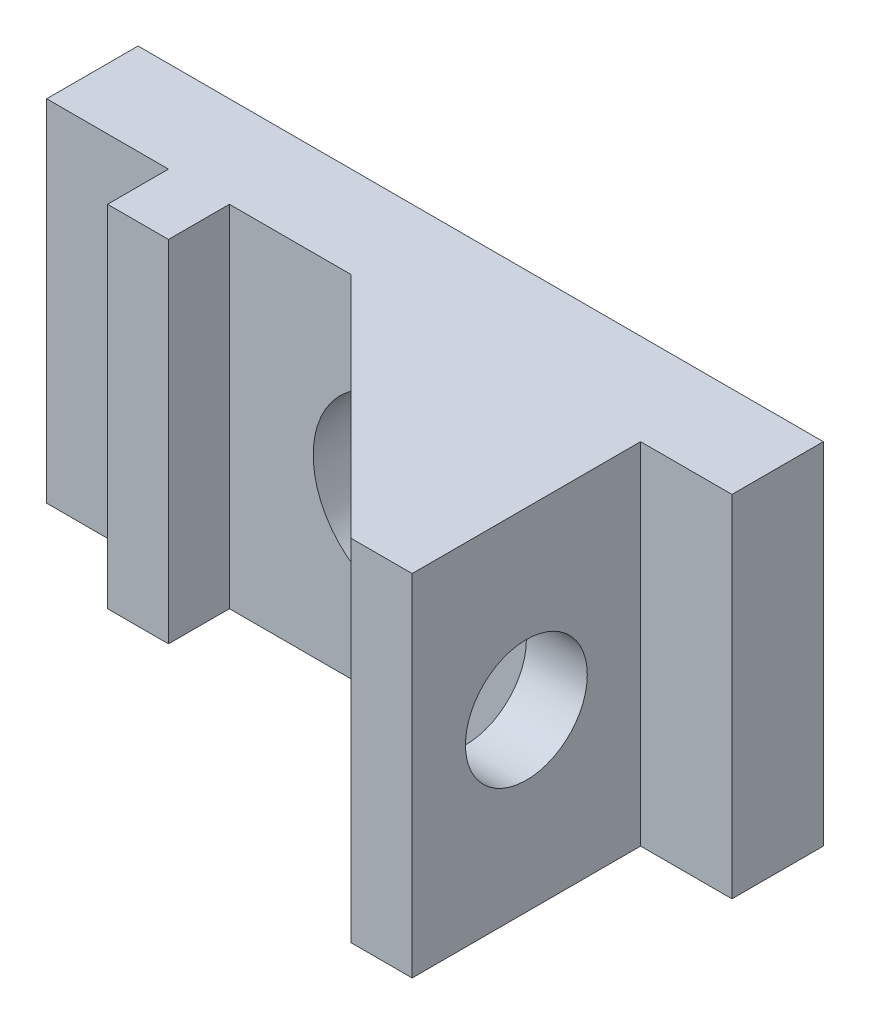
from build123d import *

# Parameters (mm, degrees)
SKETCH_1_W          = 4
SKETCH_1_H          = 4
SKETCH_1_H_2        = 15
EXTRUDE_1_DEPTH     = 23
EXTRUDE_2_DEPTH     = 4
SKETCH_3_R          = 6
CUT_EXTRUDE_1_DEPTH = 36.5
SKETCH_4_R          = 4
CUT_EXTRUDE_2_DEPTH = 4


with BuildPart() as part:
    # Эскиз1 → Бобышка-Вытянуть1 (new body)
    with BuildSketch(Plane(origin=(0, 0, 0), x_dir=(1, 0, 0), z_dir=(0, 1, 0))):
        Polygon((22.5, 10.5), (-22.5, 10.5), (-22.5, 4.5), (-14.5, 4.5), (-10.5, 4.5), (12.5, 4.5), (16.5, 4.5), (22.5, 4.5), align=None)
        with Locations((-12.5, 2.5)):
            Rectangle(SKETCH_1_W, SKETCH_1_H)
        with Locations((14.5, -3)):
            Rectangle(SKETCH_1_W, SKETCH_1_H_2)
    extrude(amount=EXTRUDE_1_DEPTH)

    # Эскиз2 → Бобышка-Вытянуть2 (add)
    with BuildSketch(Plane(origin=(0, 23, 0), x_dir=(1, 0, 0), z_dir=(0, 1, 0))):
        Polygon((12.5, -10.5), (-2.5, 4.5), (12.5, 4.5), align=None)
    extrude(amount=-EXTRUDE_2_DEPTH)

    # Эскиз3 → Вырез-Вытянуть1 (cut, through all)
    with BuildSketch(Plane.XY.offset(-4.5)):
        with Locations((1, 11.5)):
            Circle(SKETCH_3_R)
    extrude(amount=-CUT_EXTRUDE_1_DEPTH, mode=Mode.SUBTRACT)

    # Эскиз4 → Вырез-Вытянуть2 (cut)
    with BuildSketch(Plane.ZY.offset(-16.5)):
        with Locations(Location((3, 11.5, 0), (0, 0, 180))):
            Circle(SKETCH_4_R)
    extrude(amount=CUT_EXTRUDE_2_DEPTH, mode=Mode.SUBTRACT)


solid = part.part
